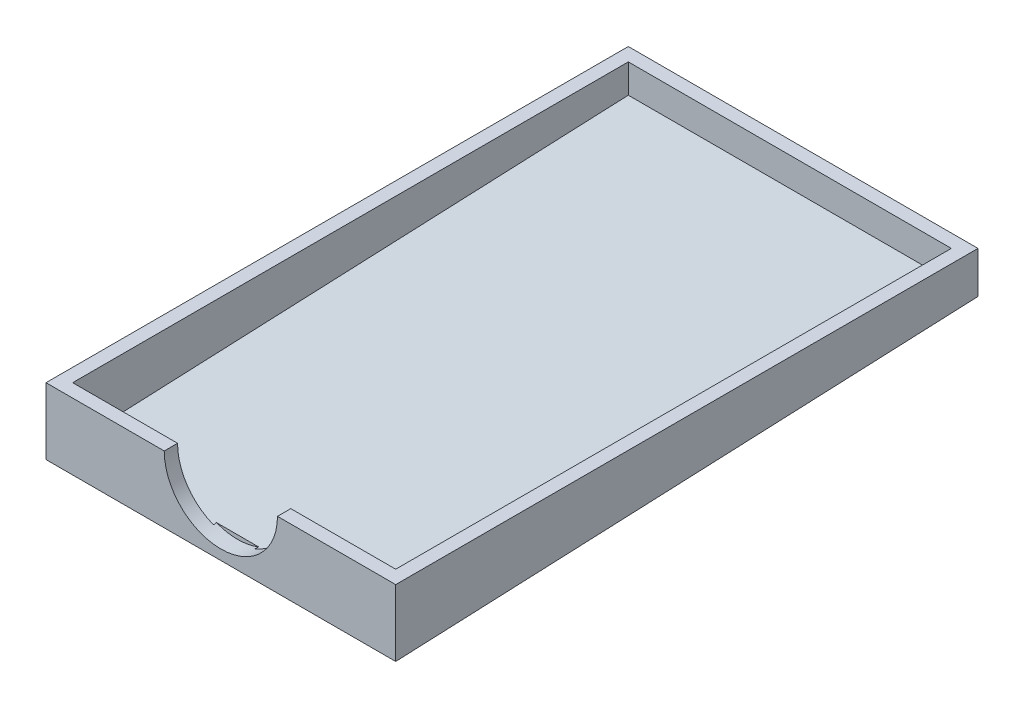
from build123d import *

# Parameters (mm, degrees)
BOSS_EXTRUDE1_DEPTH = 21
SHELL1_T            = -1.6
SKETCH2_R           = 6.8
CUT_EXTRUDE1_DEPTH  = 2


with BuildPart() as part:
    # Sketch1 → Boss-Extrude1 (new, symmetric)
    with BuildSketch(Plane(origin=(0, 0, 0), x_dir=(0, 0, -1), z_dir=(1, 0, 0))):
        Polygon((-34.96784237, -1.5), (34.96784237, 1.5), (34.96784237, 6.5), (-34.96784237, 6.5), align=None)
    extrude(amount=BOSS_EXTRUDE1_DEPTH, both=True)

    # Shell1
    shell1_openings = [part.faces().sort_by_distance(p)[0] for p in [
        (0, 6.5, 0),
    ]]
    offset(amount=SHELL1_T, openings=shell1_openings, kind=Kind.INTERSECTION)

    # Sketch2 → Cut-Extrude1 (cut)
    with BuildSketch(Plane.XY.offset(34.96784237)):
        with Locations((0, 6.5)):
            Circle(SKETCH2_R)
    extrude(amount=-CUT_EXTRUDE1_DEPTH, mode=Mode.SUBTRACT)


solid = part.part
